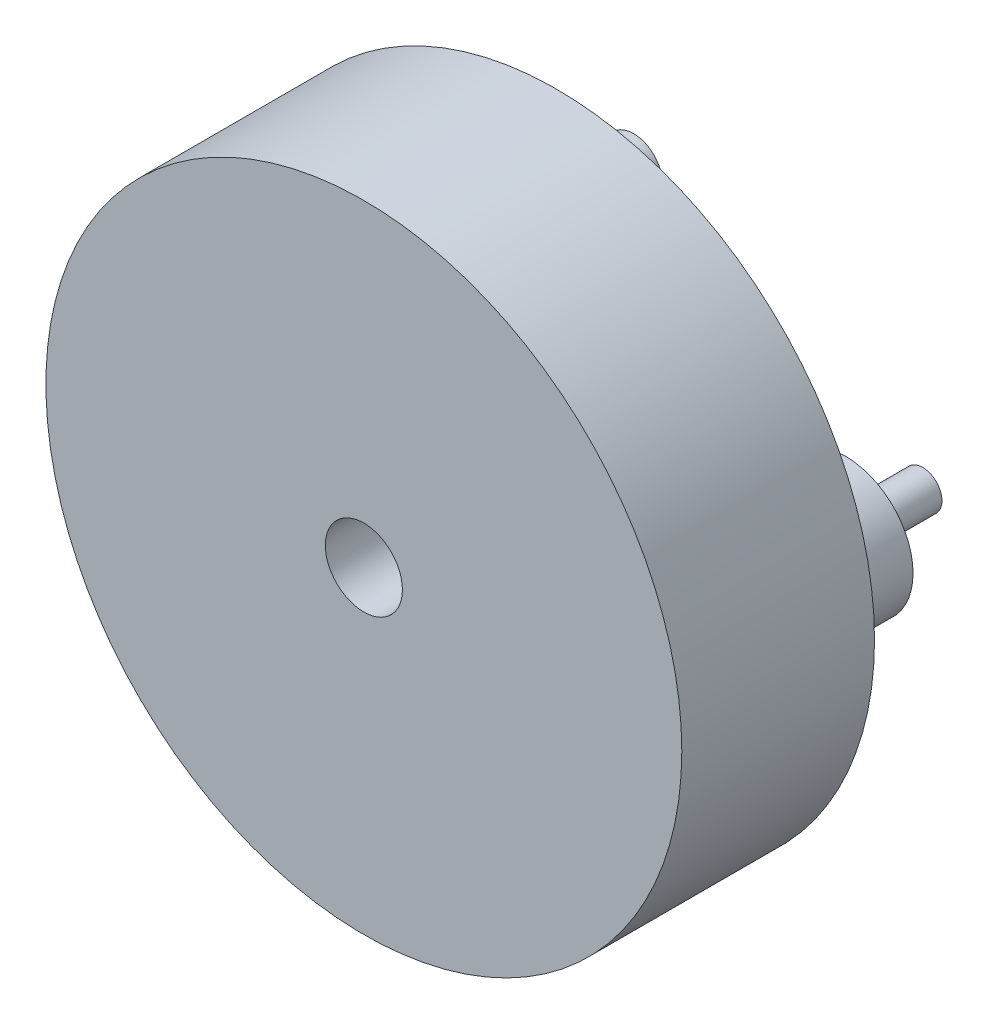
from build123d import *

# Parameters (mm, degrees)
SKETCH1_R           = 8.25
BOSS_EXTRUDE1_DEPTH = 5
SKETCH2_R           = 1
CUT_EXTRUDE1_DEPTH  = 2
SKETCH3_R           = 1.75
SKETCH3_R_2         = 0.75
BOSS_EXTRUDE2_DEPTH = 2
SKETCH4_R           = 0.5
BOSS_EXTRUDE3_DEPTH = 2


with BuildPart() as part:
    # Sketch1 → Boss-Extrude1 (new body)
    with BuildSketch(Plane.XY):
        Circle(SKETCH1_R)
    extrude(amount=BOSS_EXTRUDE1_DEPTH)

    # Sketch2 → Cut-Extrude1 (cut)
    with BuildSketch(Plane.XY.offset(5)):
        Circle(SKETCH2_R)
    extrude(amount=-CUT_EXTRUDE1_DEPTH, mode=Mode.SUBTRACT)

    # Sketch3 → Boss-Extrude2 (add)
    with BuildSketch(Plane(origin=(0, 0, 0), x_dir=(-1, 0, 0), z_dir=(0, 0, -1))):
        with Locations(Location((-5.5, 0, 0), (0, 0, 180))):
            Circle(SKETCH3_R)
        with Locations(Location((5.5, 0, 0), (0, 0, 180))):
            Circle(SKETCH3_R)
        with Locations(Location((0, 5.5, 0), (0, 0, 180))):
            Circle(SKETCH3_R_2)
        with Locations(Location((0, -5.5, 0), (0, 0, 180))):
            Circle(SKETCH3_R_2)
    extrude(amount=BOSS_EXTRUDE2_DEPTH)

    # Sketch4 → Boss-Extrude3 (add)
    with BuildSketch(Plane(origin=(0, 0, -2), x_dir=(-1, 0, 0), z_dir=(0, 0, -1))):
        with Locations((-5.5, 0)):
            Circle(SKETCH4_R)
        with Locations((5.5, 0)):
            Circle(SKETCH4_R)
    extrude(amount=BOSS_EXTRUDE3_DEPTH)


solid = part.part
